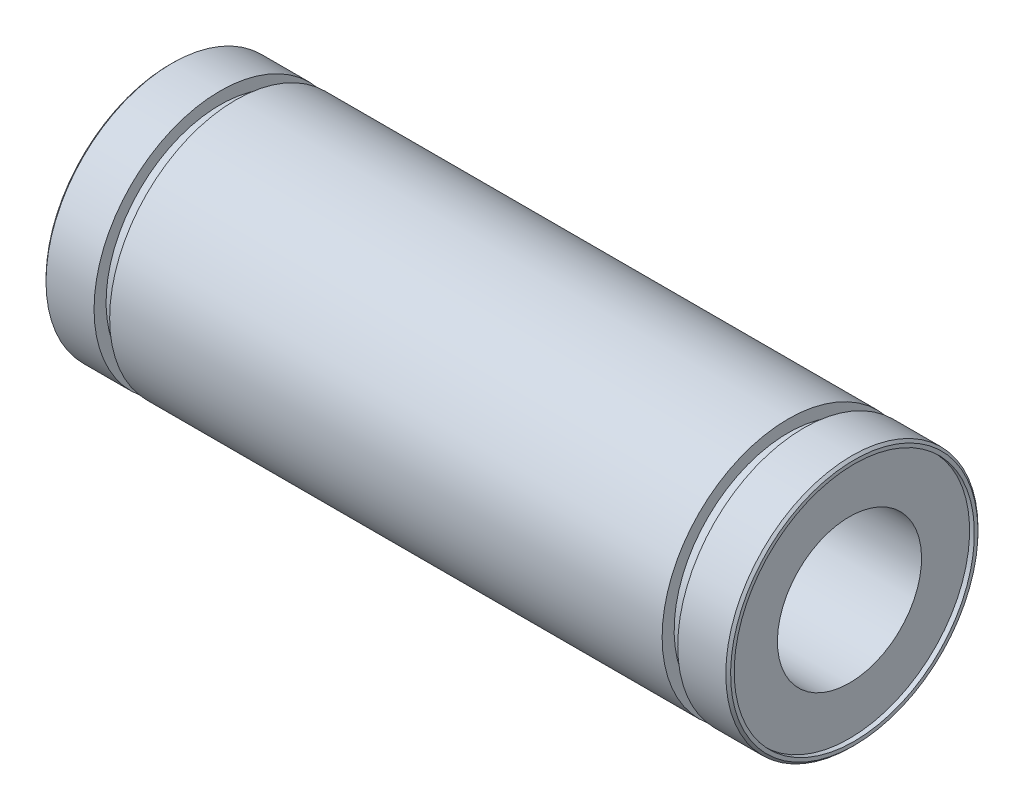
from build123d import *


with BuildPart() as part:
    # Sketch1 → Revolve2 (revolve)
    with BuildSketch(Plane.XY, mode=Mode.PRIVATE) as revolve2_sk:
        Polygon((28.1, 10), (28.5, 10), (28.5, 10.3), (28.3, 10.5), (24.3, 10.5), (24.3, 9.5), (23, 9.5), (23, 10.5), (-23, 10.5), (-23, 9.5), (-24.3, 9.5), (-24.3, 10.5), (-28.3, 10.5), (-28.5, 10.3), (-28.5, 10), (-28.1, 10), (-28.1, 6), (28.1, 6), align=None)
    revolve(revolve2_sk.sketch.rotate(Axis((-28.5, 0, 0), (1, 0, 0)), 180), axis=Axis((-28.5, 0, 0), (1, 0, 0)))


solid = part.part
